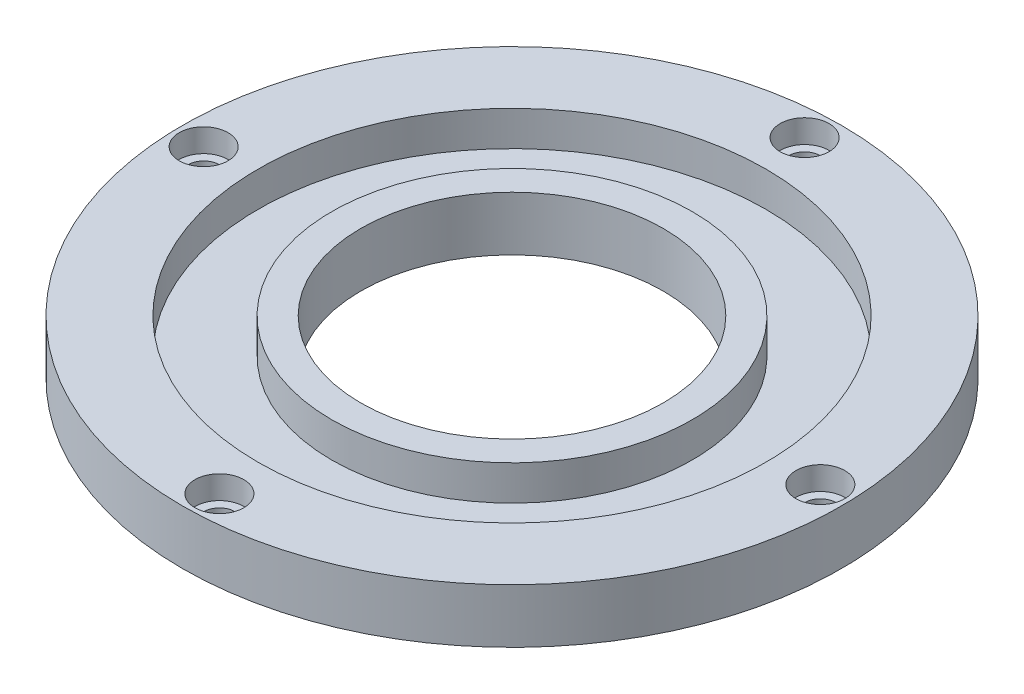
from build123d import *

# Parameters (mm, degrees)
SKETCH1_R           = 42.5
SKETCH1_R_2         = 19.5
BOSS_EXTRUDE1_DEPTH = 7
SKETCH2_R           = 32.75
SKETCH2_R_2         = 23.25
CUT_EXTRUDE1_DEPTH  = 4.5
SKETCH3_R           = 2
CUT_EXTRUDE2_DEPTH  = 61.510329697
SKETCH4_R           = 3.15
SKETCH4_R_2         = 2
CUT_EXTRUDE3_DEPTH  = 3


with BuildPart() as part:
    # Sketch1 → Boss-Extrude1 (new body)
    with BuildSketch(Plane(origin=(0, 0, 0), x_dir=(1, 0, 0), z_dir=(0, 1, 0))):
        with Locations(Location((0, 0, 0), (0, 0, 270))):
            Circle(SKETCH1_R)
        with Locations(Location((0, 0, 0), (0, 0, 270))):
            Circle(SKETCH1_R_2, mode=Mode.SUBTRACT)
    extrude(amount=BOSS_EXTRUDE1_DEPTH)

    # Sketch2 → Cut-Extrude1 (cut)
    with BuildSketch(Plane(origin=(0, 7, 0), x_dir=(1, 0, 0), z_dir=(0, 1, 0))):
        with Locations(Location((0, 0, 0), (0, 0, 270))):
            Circle(SKETCH2_R)
        with Locations(Location((0, 0, 0), (0, 0, 270))):
            Circle(SKETCH2_R_2, mode=Mode.SUBTRACT)
    extrude(amount=-CUT_EXTRUDE1_DEPTH, mode=Mode.SUBTRACT)

    # Sketch3 → Cut-Extrude2 (cut, through all)
    with BuildSketch(Plane(origin=(0, 7, 0), x_dir=(1, 0, 0), z_dir=(0, 1, 0))):
        with Locations(Location((-38.75, -1.015406046, 0), (0, 0, 270))):
            Circle(SKETCH3_R)
        with Locations(Location((-1.015406046, 38.75, 0), (0, 0, 270))):
            Circle(SKETCH3_R)
        with Locations(Location((38.75, 1.015406046, 0), (0, 0, 270))):
            Circle(SKETCH3_R)
        with Locations(Location((1.015406046, -38.75, 0), (0, 0, 270))):
            Circle(SKETCH3_R)
    extrude(amount=-CUT_EXTRUDE2_DEPTH, mode=Mode.SUBTRACT)

    # Sketch4 → Cut-Extrude3 (cut)
    # profile 1 of 4: a face of its own
    with BuildSketch(Plane(origin=(0, 7, 0), x_dir=(1, 0, 0), z_dir=(0, 1, 0))):
        with Locations(Location((-1.015406046, 38.75, 0), (0, 0, 270))):
            Circle(SKETCH4_R)
        with Locations(Location((-1.015406046, 38.75, 0), (0, 0, 270))):
            Circle(SKETCH4_R_2, mode=Mode.SUBTRACT)
    # profile 2 of 4: a face of its own
    with BuildSketch(Plane(origin=(0, 7, 0), x_dir=(1, 0, 0), z_dir=(0, 1, 0))):
        with Locations(Location((38.75, 1.015406046, 0), (0, 0, 270))):
            Circle(SKETCH4_R)
    # profile 3 of 4: a face of its own
    with BuildSketch(Plane(origin=(0, 7, 0), x_dir=(1, 0, 0), z_dir=(0, 1, 0))):
        with Locations(Location((1.015406046, -38.75, 0), (0, 0, 270))):
            Circle(SKETCH4_R)
    # profile 4 of 4: a face of its own
    with BuildSketch(Plane(origin=(0, 7, 0), x_dir=(1, 0, 0), z_dir=(0, 1, 0))):
        with Locations(Location((-38.75, -1.015406046, 0), (0, 0, 270))):
            Circle(SKETCH4_R)
    extrude(amount=-CUT_EXTRUDE3_DEPTH, mode=Mode.SUBTRACT)


solid = part.part
